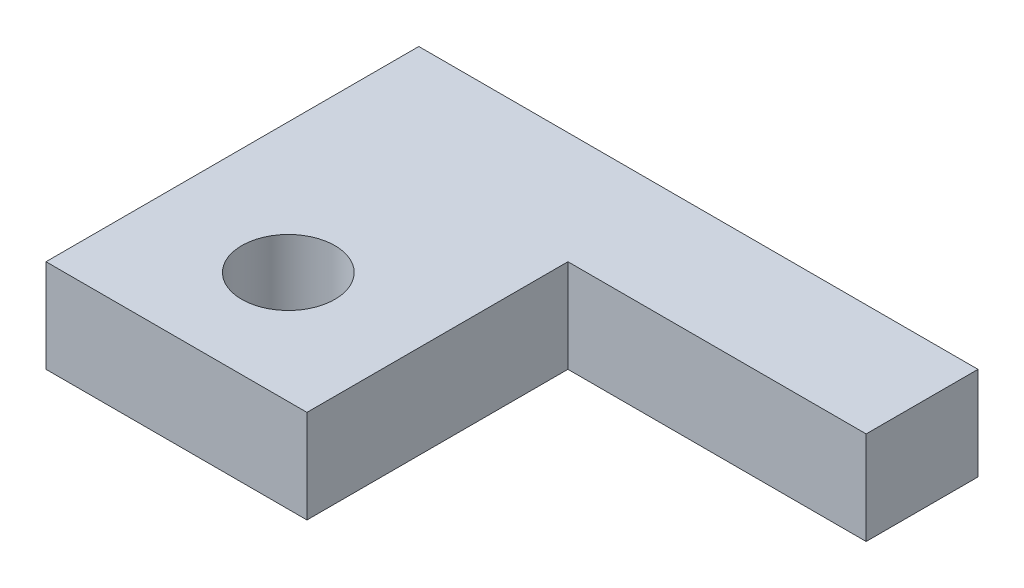
from build123d import *

# Parameters (mm, degrees)
SKETCH4_W           = 7
SKETCH4_H           = 7
SKETCH4_R           = 1.25
BOSS_EXTRUDE2_DEPTH = 2.5


with BuildPart() as part:
    # Sketch4 → Boss-Extrude2 (new body)
    # profile 1 of 2: a face of its own
    with BuildSketch(Plane(origin=(0, 0, 0), x_dir=(1, 0, 0), z_dir=(0, 1, 0))):
        with Locations((-3.5, 3.5)):
            Rectangle(SKETCH4_W, SKETCH4_H)
        with Locations(Location((-3.5, 3, 0), (0, 0, 270))):
            Circle(SKETCH4_R, mode=Mode.SUBTRACT)
    # profile 2 of 2: a face of its own
    with BuildSketch(Plane(origin=(0, 0, 0), x_dir=(1, 0, 0), z_dir=(0, 1, 0))):
        Polygon((-7, 7), (0, 7), (8, 7), (8, 10), (-7, 10), align=None)
    extrude(amount=BOSS_EXTRUDE2_DEPTH)


solid = part.part
